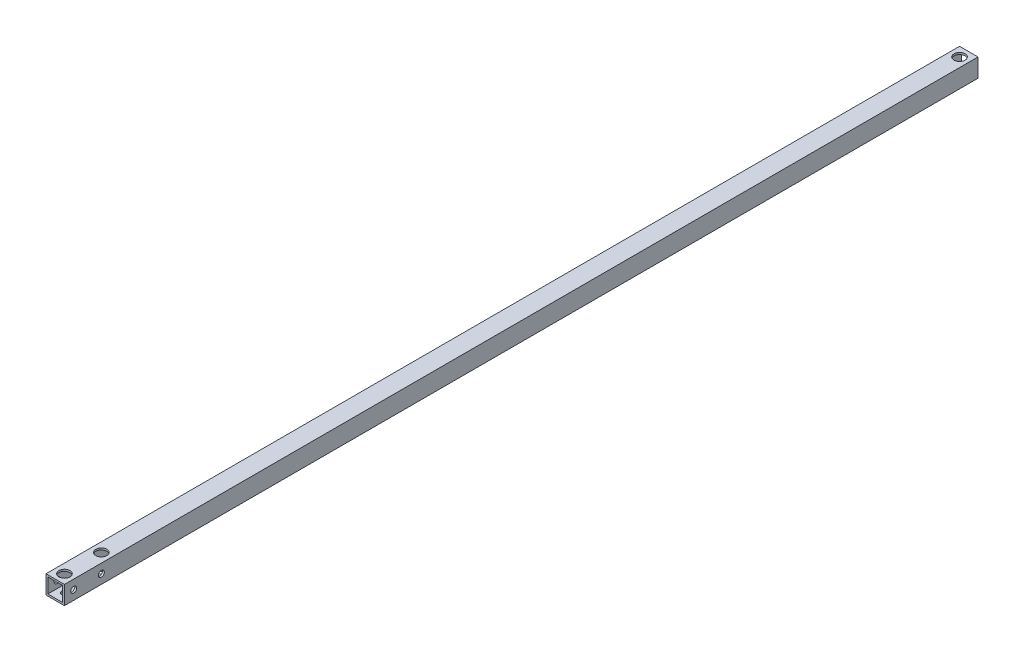
from build123d import *

# Parameters (mm, degrees)
SKETCH_1_W          = 10
SKETCH_1_H          = 10
SKETCH_1_W_2        = 8
SKETCH_1_H_2        = 8
EXTRUDE_1_DEPTH     = 495
SKETCH_2_R          = 1.6
CUT_EXTRUDE_1_DEPTH = 496.126246527
CUT_EXTRUDE_2_REACH = 497.126
SKETCH_3_R          = 3
SKETCH_8_R          = 1.6
CUT_EXTRUDE_7_DEPTH = 496.126246527


with BuildPart() as part:
    # ｽｹｯﾁ1 → 押し出し-薄板1 (new body)
    with BuildSketch(Plane.XY):
        Rectangle(SKETCH_1_W, SKETCH_1_H)
        Rectangle(SKETCH_1_W_2, SKETCH_1_H_2, mode=Mode.SUBTRACT)
    extrude(amount=EXTRUDE_1_DEPTH)

    # ｽｹｯﾁ2 → ｶｯﾄ - 押し出し1 (cut, through all)
    with BuildSketch(Plane(origin=(0, 5, 0), x_dir=(1, 0, 0), z_dir=(0, 1, 0))):
        with Locations(Location((0, -5, 0), (0, 0, 180))):
            Circle(SKETCH_2_R)
        with Locations(Location((0, -490, 0), (0, 0, 180))):
            Circle(SKETCH_2_R)
        with Locations(Location((0, -470, 0), (0, 0, 180))):
            Circle(SKETCH_2_R)
    extrude(amount=-CUT_EXTRUDE_1_DEPTH, mode=Mode.SUBTRACT)

    # ｽｹｯﾁ3 → ｶｯﾄ - 押し出し2 (cut, up to next)
    with BuildSketch(Plane(origin=(0, 5, 0), x_dir=(1, 0, 0), z_dir=(0, 1, 0)), mode=Mode.PRIVATE) as cut_extrude_2_sk1:
        with Locations(Location((0, -5, 0), (0, 0, 180))):
            Circle(SKETCH_3_R)
    cut_extrude_2_tool1 = extrude(cut_extrude_2_sk1.sketch, amount=-CUT_EXTRUDE_2_REACH, mode=Mode.PRIVATE) & part.part
    # ｽｹｯﾁ3 → ｶｯﾄ - 押し出し2 (cut, up to next)
    with BuildSketch(Plane(origin=(0, 5, 0), x_dir=(1, 0, 0), z_dir=(0, 1, 0)), mode=Mode.PRIVATE) as cut_extrude_2_sk2:
        with Locations(Location((0, -490, 0), (0, 0, 180))):
            Circle(SKETCH_3_R)
    cut_extrude_2_tool2 = extrude(cut_extrude_2_sk2.sketch, amount=-CUT_EXTRUDE_2_REACH, mode=Mode.PRIVATE) & part.part
    # ｽｹｯﾁ3 → ｶｯﾄ - 押し出し2 (cut, up to next)
    with BuildSketch(Plane(origin=(0, 5, 0), x_dir=(1, 0, 0), z_dir=(0, 1, 0)), mode=Mode.PRIVATE) as cut_extrude_2_sk3:
        with Locations(Location((0, -470, 0), (0, 0, 180))):
            Circle(SKETCH_3_R)
    cut_extrude_2_tool3 = extrude(cut_extrude_2_sk3.sketch, amount=-CUT_EXTRUDE_2_REACH, mode=Mode.PRIVATE) & part.part
    add(cut_extrude_2_tool1.solids().sort_by_distance((0, 5, 5))[0], mode=Mode.SUBTRACT)
    add(cut_extrude_2_tool2.solids().sort_by_distance((0, 5, 490))[0], mode=Mode.SUBTRACT)
    add(cut_extrude_2_tool3.solids().sort_by_distance((0, 5, 470))[0], mode=Mode.SUBTRACT)

    # ｽｹｯﾁ8 → ｶｯﾄ - 押し出し7 (cut, through all)
    with BuildSketch(Plane(origin=(5, 0, 0), x_dir=(0, 0, -1), z_dir=(1, 0, 0))):
        with Locations(Location((-490, 0, 0), (0, 0, 90))):
            Circle(SKETCH_8_R)
        with Locations(Location((-475, 0, 0), (0, 0, 90))):
            Circle(SKETCH_8_R)
    extrude(amount=-CUT_EXTRUDE_7_DEPTH, mode=Mode.SUBTRACT)


solid = part.part
